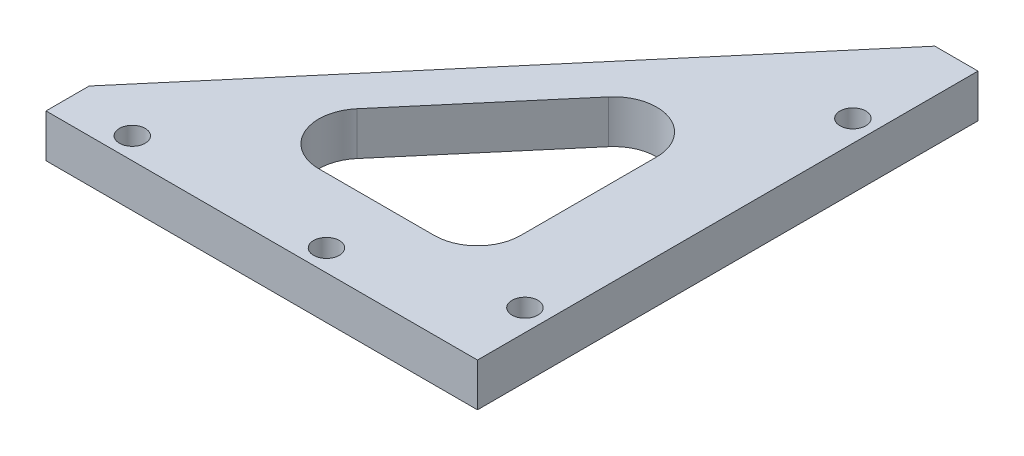
from build123d import *

# Parameters (mm, degrees)
BOSS_EXTRUDE1_DEPTH       = 6.35
F_6_CLEARANCE_HOLE1_D     = 3.7973
F_6_CLEARANCE_HOLE1_DEPTH = 12.7
F_6_CLEARANCE_HOLE1_TIP   = 1.140824014
FILLET1_R                 = 6.35


with BuildPart() as part:
    # Sketch1 → Boss-Extrude1 (new body)
    with BuildSketch(Plane(origin=(0, 0, 0), x_dir=(1, 0, 0), z_dir=(0, 1, 0))):
        Polygon((0, 0), (63.5, 0), (63.5, 73.66), (57.15, 73.66), (0, 6.35), align=None)
        Polygon((13.721627919, 12.7), (50.8, 12.7), (50.8, 56.370082673), align=None, mode=Mode.SUBTRACT)
    extrude(amount=BOSS_EXTRUDE1_DEPTH)

    # #6 Clearance Hole1
    with Locations(Plane(origin=(0, 6.35, 0), x_dir=(1, 0, 0), z_dir=(0, 1, 0))):
        with Locations((9.525, 3.175), (38.1, 3.175), (60.325, 10.16), (60.325, 58.42)):
            Hole(F_6_CLEARANCE_HOLE1_D / 2, depth=F_6_CLEARANCE_HOLE1_DEPTH)
            with Locations((0, 0, -(F_6_CLEARANCE_HOLE1_DEPTH + F_6_CLEARANCE_HOLE1_TIP / 2))):  # 118° drill point
                Cone(0, F_6_CLEARANCE_HOLE1_D / 2, F_6_CLEARANCE_HOLE1_TIP, mode=Mode.SUBTRACT)

    # Fillet1
    fillet1_edges = [part.edges().sort_by_distance(p)[0] for p in [
        (50.8, 3.175, -12.7),
        (50.8, 3.175, -56.370082673),
        (13.721627919, 3.175, -12.7),
    ]]
    fillet(fillet1_edges, radius=FILLET1_R)


solid = part.part
